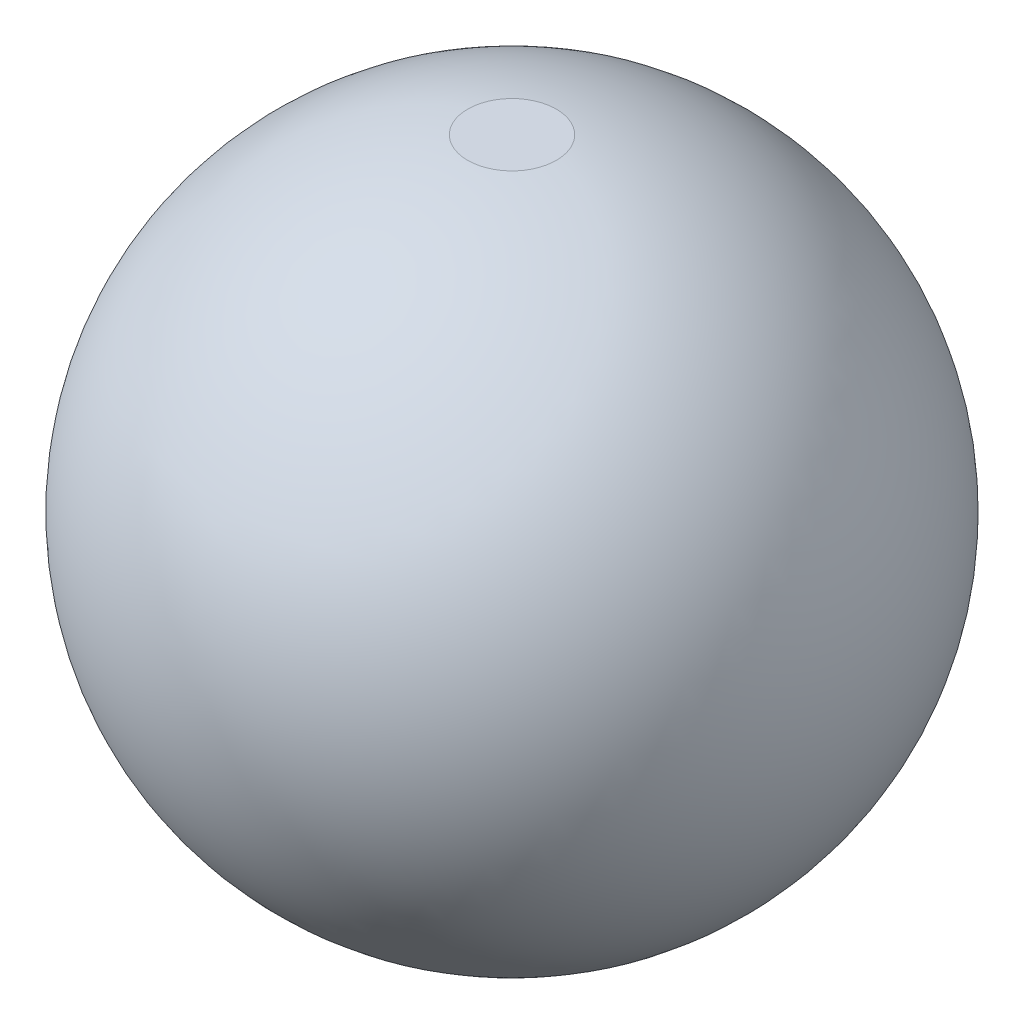
from build123d import *

# Parameters (mm, degrees)
SKETCH_2_R          = 0.515275177
CUT_EXTRUDE_1_DEPTH = 10


with BuildPart() as part:
    # 草图1 → 旋转1 (revolve)
    with BuildSketch(Plane(origin=(0, 0, 0), x_dir=(1, 0, 0), z_dir=(0, 1, 0))):
        with BuildLine():
            Line((0, 1.1), (0, -1.1))
            ThreePointArc((0, -1.1), (-1.1, 0), (0, 1.1))
        make_face()
    revolve(axis=Axis((0, 0, -1.1), (0, 0, 1)))

    # 草图2 → 切除-拉伸1 (cut)
    with BuildSketch(Plane(origin=(0, 1.09, 0), x_dir=(1, 0, 0), z_dir=(0, 1, 0))):
        Circle(SKETCH_2_R)
    extrude(amount=CUT_EXTRUDE_1_DEPTH, mode=Mode.SUBTRACT)


solid = part.part
